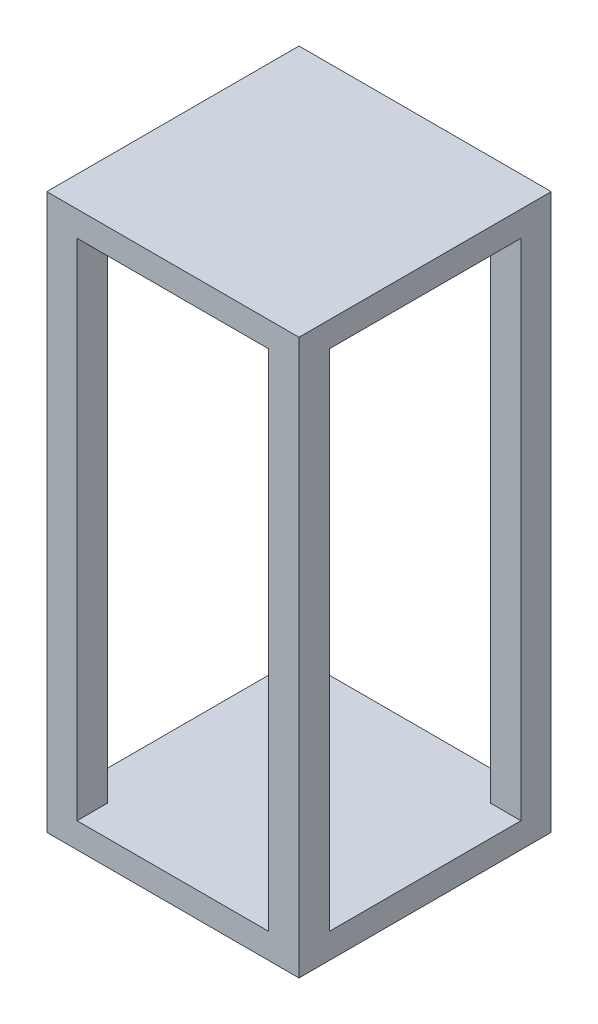
from build123d import *

# Parameters (mm, degrees)
SCHIZZO1_W                   = 50
SCHIZZO1_H                   = 50
ESTRUSIONE_ESTRUSIONE1_DEPTH = 5
SCHIZZO2_W                   = 6
SCHIZZO2_H                   = 6
ESTRUSIONE_ESTRUSIONE2_DEPTH = 100
SCHIZZO3_W                   = 50
SCHIZZO3_H                   = 50
ESTRUSIONE_ESTRUSIONE3_DEPTH = 5
SCHIZZO4_R                   = 5
SCHIZZO4_R_2                 = 3
ESTRUSIONE_ESTRUSIONE4_DEPTH = 1.25
RACCORDO1_R                  = 0.9


with BuildPart() as part:
    # Schizzo1 → Estrusione-Estrusione1 (new body)
    with BuildSketch(Plane(origin=(0, 0, 0), x_dir=(1, 0, 0), z_dir=(0, 1, 0))):
        Rectangle(SCHIZZO1_W, SCHIZZO1_H)
    extrude(amount=ESTRUSIONE_ESTRUSIONE1_DEPTH)

    # Schizzo2 → Estrusione-Estrusione2 (add)
    with BuildSketch(Plane(origin=(0, 5, 0), x_dir=(1, 0, 0), z_dir=(0, 1, 0))):
        with Locations((22, 22)):
            Rectangle(SCHIZZO2_W, SCHIZZO2_H)
        with Locations((-22, 22)):
            Rectangle(SCHIZZO2_W, SCHIZZO2_H)
        with Locations((22, -22)):
            Rectangle(SCHIZZO2_W, SCHIZZO2_H)
        with Locations((-22, -22)):
            Rectangle(SCHIZZO2_W, SCHIZZO2_H)
    extrude(amount=ESTRUSIONE_ESTRUSIONE2_DEPTH)

    # Schizzo3 → Estrusione-Estrusione3 (add)
    with BuildSketch(Plane(origin=(0, 105, 0), x_dir=(1, 0, 0), z_dir=(0, 1, 0))):
        Rectangle(SCHIZZO3_W, SCHIZZO3_H)
    extrude(amount=ESTRUSIONE_ESTRUSIONE3_DEPTH)


with BuildPart() as body_2:
    # Schizzo4 → Estrusione-Estrusione4 (new, symmetric)
    with BuildSketch(Plane.XY):
        with Locations((0, 101.50135613)):
            Circle(SCHIZZO4_R)
        with Locations((0, 101.50135613)):
            Circle(SCHIZZO4_R_2, mode=Mode.SUBTRACT)
    extrude(amount=ESTRUSIONE_ESTRUSIONE4_DEPTH, both=True)

    # Raccordo1
    raccordo1_edges = [body_2.edges().sort_by_distance(p)[0] for p in [
        (-5, 101.50135613, -1.25),
        (-5, 101.50135613, 1.25),
        (-3, 101.50135613, -1.25),
        (-3, 101.50135613, 1.25),
    ]]
    fillet(raccordo1_edges, radius=RACCORDO1_R)


solid = Compound([part.part, body_2.part])
